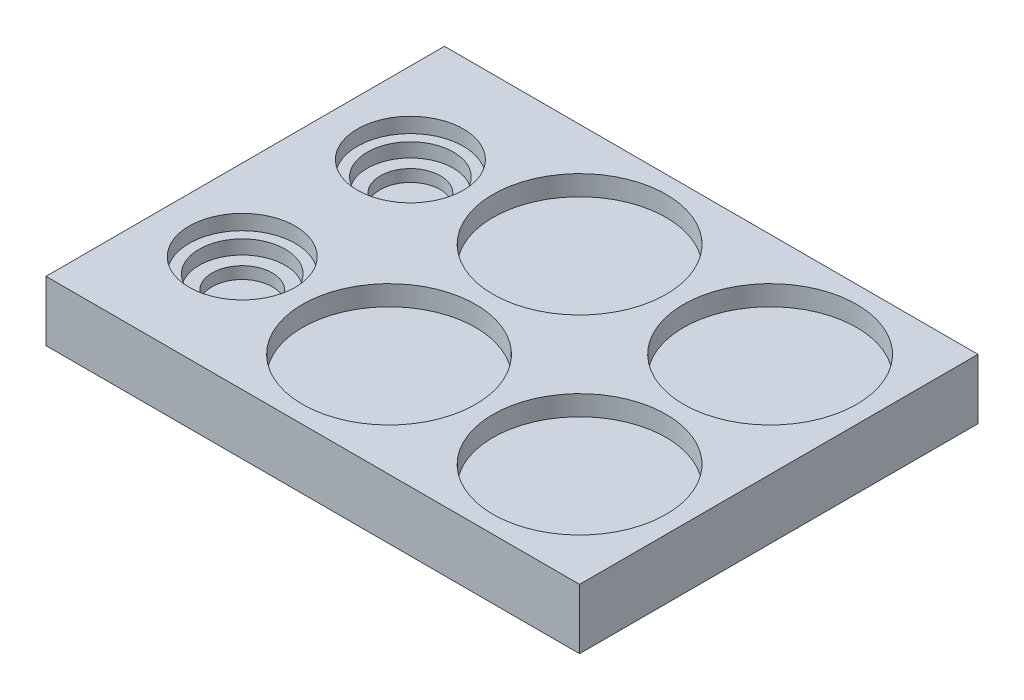
from build123d import *

# Parameters (mm, degrees)
SKETCH_1_W            = 533
SKETCH_1_H            = 398
EXTRUDE_237_DEPTH     = 60
SKETCH_2_R            = 86.5
CUT_EXTRUDE_597_DEPTH = 20
SKETCH_3_R            = 53
CUT_EXTRUDE_101_DEPTH = 15
SKETCH_6_R            = 43
CUT_EXTRUDE_5_DEPTH   = 14
SKETCH_7_R            = 30
CUT_EXTRUDE_6_DEPTH   = 12


with BuildPart() as part:
    # Эскиз1 → Extrude 237 (new body)
    with BuildSketch(Plane(origin=(0, 0, 0), x_dir=(1, 0, 0), z_dir=(0, 1, 0))):
        with Locations((266.5, 199)):
            Rectangle(SKETCH_1_W, SKETCH_1_H)
    extrude(amount=-EXTRUDE_237_DEPTH)

    # Эскиз2 → Р597 (cut)
    with BuildSketch(Plane(origin=(0, 0, 0), x_dir=(1, 0, 0), z_dir=(0, 1, 0))):
        with Locations(Location((429.166666667, 103.833333333, 0), (0, 0, 270))):
            Circle(SKETCH_2_R)
        with Locations(Location((238.833333333, 103.833333333, 0), (0, 0, 270))):
            Circle(SKETCH_2_R)
        with Locations(Location((238.833333333, 294.166666667, 0), (0, 0, 270))):
            Circle(SKETCH_2_R)
        with Locations(Location((429.166666667, 294.166666667, 0), (0, 0, 270))):
            Circle(SKETCH_2_R)
    extrude(amount=-CUT_EXTRUDE_597_DEPTH, mode=Mode.SUBTRACT)

    # Эскиз3 → КМЕ-101 (cut)
    with BuildSketch(Plane(origin=(0, 0, 0), x_dir=(1, 0, 0), z_dir=(0, 1, 0))):
        with Locations(Location((81, 283, 0), (0, 0, 270))):
            Circle(SKETCH_3_R)
        with Locations(Location((81, 115, 0), (0, 0, 270))):
            Circle(SKETCH_3_R)
    extrude(amount=-CUT_EXTRUDE_101_DEPTH, mode=Mode.SUBTRACT)

    # Эскиз6 → Вырез-Вытянуть5 (cut)
    with BuildSketch(Plane(origin=(0, -15, 0), x_dir=(1, 0, 0), z_dir=(0, 1, 0))):
        with Locations(Location((81, 283, 0), (0, 0, 270))):
            Circle(SKETCH_6_R)
        with Locations(Location((81, 115, 0), (0, 0, 270))):
            Circle(SKETCH_6_R)
    extrude(amount=-CUT_EXTRUDE_5_DEPTH, mode=Mode.SUBTRACT)

    # Эскиз7 → Вырез-Вытянуть6 (cut)
    with BuildSketch(Plane(origin=(0, -29, 0), x_dir=(1, 0, 0), z_dir=(0, 1, 0))):
        with Locations(Location((81, 283, 0), (0, 0, 270))):
            Circle(SKETCH_7_R)
        with Locations(Location((81, 115, 0), (0, 0, 270))):
            Circle(SKETCH_7_R)
    extrude(amount=-CUT_EXTRUDE_6_DEPTH, mode=Mode.SUBTRACT)


solid = part.part
